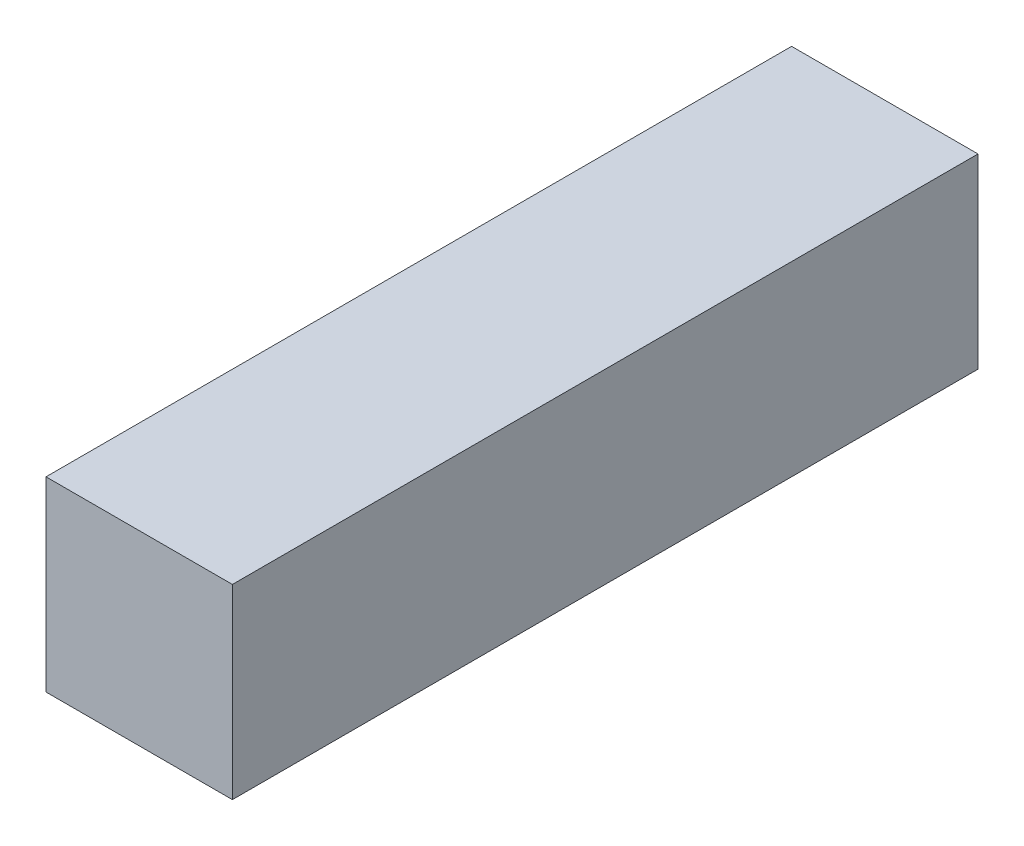
from build123d import *

# Parameters (mm, degrees)
SKETCH1_W           = 3.175
SKETCH1_H           = 3.175
BOSS_EXTRUDE1_DEPTH = 12.7


with BuildPart() as part:
    # Sketch1 → Boss-Extrude1 (new body)
    with BuildSketch(Plane.XY):
        Rectangle(SKETCH1_W, SKETCH1_H)
    extrude(amount=BOSS_EXTRUDE1_DEPTH)


solid = part.part
